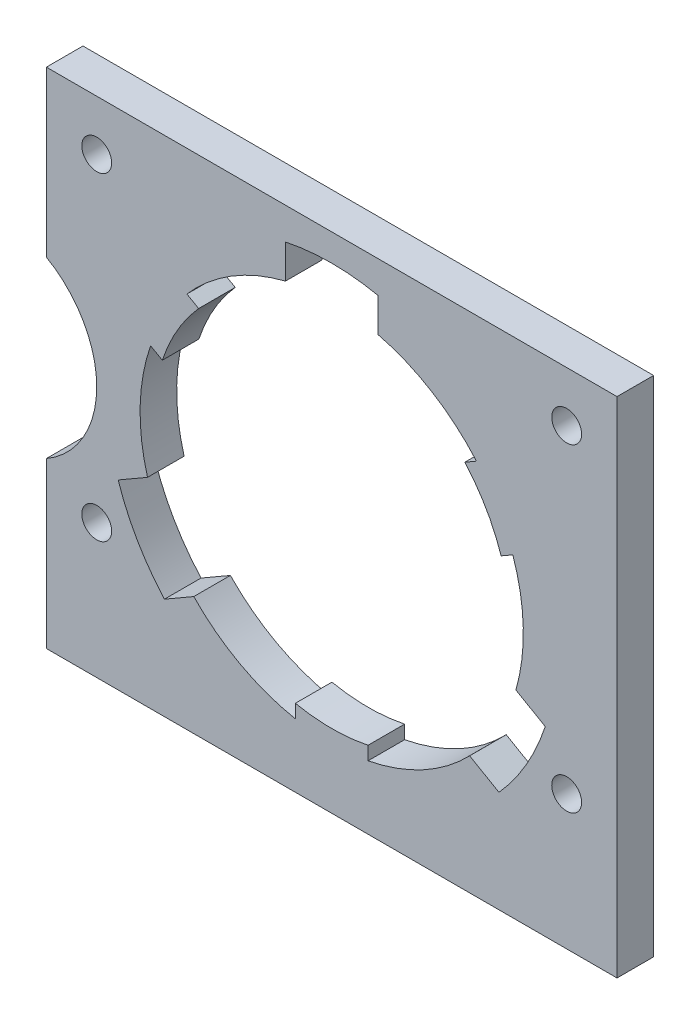
from build123d import *

# Parameters (mm, degrees)
SKETCH1_W             = 43.18
SKETCH1_H             = 38.1
BOSS_EXTRUDE1_DEPTH   = 2.7686
SKETCH2_R             = 14.5
CUT_EXTRUDE1_DEPTH    = 29.925693526
CUT_EXTRUDE2_DEPTH    = 29.925693526
CIRPATTERN1_COUNT     = 3
BOSS_EXTRUDE2_DEPTH   = 2.7686
CIRPATTERN2_COUNT     = 3
SKETCH6_R             = 7.62
CUT_EXTRUDE4_DEPTH    = 29.925693526
F_4_40_TAPPED_HOLE1_D = 2.2606


with BuildPart() as part:
    # Sketch1 → Boss-Extrude1 (new body)
    with BuildSketch(Plane.XY):
        Rectangle(SKETCH1_W, SKETCH1_H)
    extrude(amount=BOSS_EXTRUDE1_DEPTH)

    # Sketch2 → Cut-Extrude1 (cut, through all)
    with BuildSketch(Plane.XY.offset(2.7686)):
        Circle(SKETCH2_R)
    extrude(amount=-CUT_EXTRUDE1_DEPTH, mode=Mode.SUBTRACT)

    # Sketch3 → Cut-Extrude2 (cut, through all)
    with BuildSketch(Plane.XY.offset(2.7686)):
        with BuildLine():
            Line((-3.5, 16.63580476), (-3.5, 14.071247279))
            ThreePointArc((-3.5, 14.071247279), (0, 14.5), (3.5, 14.071247279))
            Line((3.5, 14.071247279), (3.5, 16.63580476))
            ThreePointArc((3.5, 16.63580476), (0, 17), (-3.5, 16.63580476))
        make_face()
    cut_extrude2 = extrude(amount=-CUT_EXTRUDE2_DEPTH, mode=Mode.SUBTRACT)

    # CirPattern1: Cut-Extrude2 ×3 about axis
    cirpattern1_axis = Axis((0, 0, 0), (0, 0, 1))
    for i in range(1, CIRPATTERN1_COUNT):
        add(cut_extrude2.rotate(cirpattern1_axis, i * 360 / CIRPATTERN1_COUNT), mode=Mode.SUBTRACT)

    # Sketch4 → Boss-Extrude2 (add)
    with BuildSketch(Plane.XY.offset(2.7686)):
        with BuildLine():
            Line((-2.75, -13.216939888), (-2.75, -14.236836025))
            ThreePointArc((-2.75, -14.236836025), (0, -14.5), (2.75, -14.236836025))
            Line((2.75, -14.236836025), (2.75, -13.216939888))
            ThreePointArc((2.75, -13.216939888), (0, -13.5), (-2.75, -13.216939888))
        make_face()
    boss_extrude2 = extrude(amount=-BOSS_EXTRUDE2_DEPTH)

    # CirPattern2: Boss-Extrude2 ×3 about axis
    cirpattern2_axis = Axis((0, 0, 0), (0, 0, 1))
    for i in range(1, CIRPATTERN2_COUNT):
        add(boss_extrude2.rotate(cirpattern2_axis, i * 360 / CIRPATTERN2_COUNT))

    # Sketch6 → Cut-Extrude4 (cut, through all)
    with BuildSketch(Plane.XY.offset(2.7686)):
        with Locations((-25.4, 0)):
            Circle(SKETCH6_R)
    extrude(amount=-CUT_EXTRUDE4_DEPTH, mode=Mode.SUBTRACT)

    # #4-40 Tapped Hole1 (through all)
    with Locations(Plane(origin=(0, 0, 0), x_dir=(-1, 0, 0), z_dir=(0, 0, -1))):
        with Locations((-17.78, 15.24), (-17.78, -8.89), (17.78, -8.89), (17.78, 15.24)):
            Hole(F_4_40_TAPPED_HOLE1_D / 2)


solid = part.part
